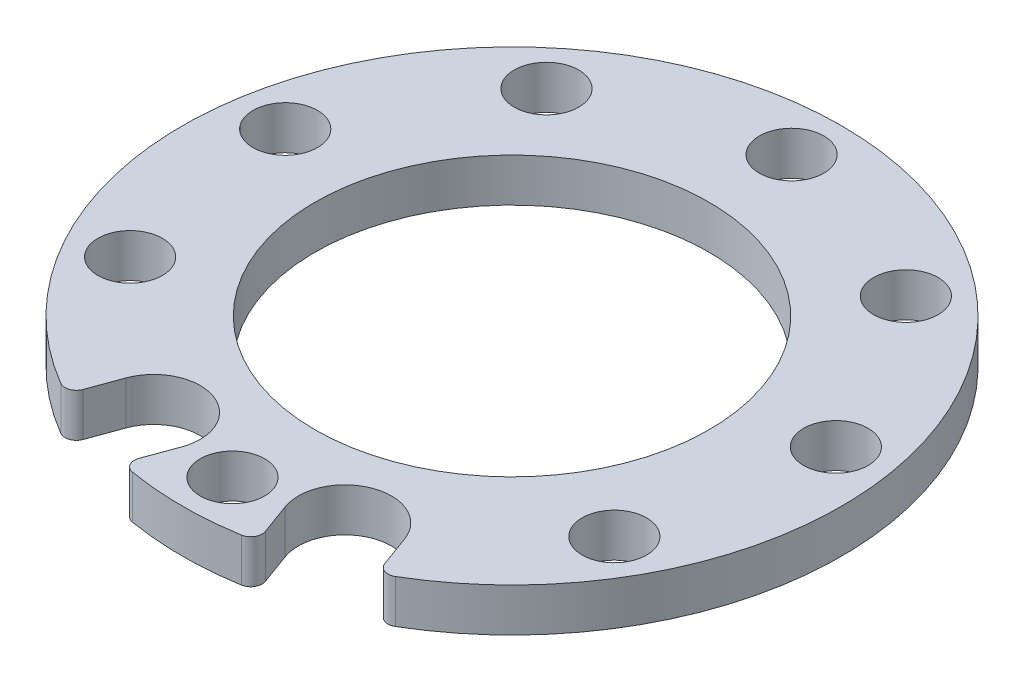
from build123d import *

# Parameters (mm, degrees)
SKETCH1_R            = 45.974
SKETCH1_R_2          = 27.4955
SKETCH1_R_3          = 6.5
BOSS_EXTRUDE1_DEPTH  = 6.04774
M8_CLEARANCE_HOLE1_D = 9
CIRPATTERN1_COUNT    = 18
CUT_EXTRUDE1_DEPTH   = 66.297722097
FILLET1_R            = 1.5875
FILLET1_OF_MIRROR1_R = 1.5875


with BuildPart() as part:
    # Sketch1 → Boss-Extrude1 (new body)
    with BuildSketch(Plane(origin=(0, 0, 0), x_dir=(1, 0, 0), z_dir=(0, 1, 0))):
        with Locations(Location((0, 0, 0), (0, 0, 270))):
            Circle(SKETCH1_R)
        with Locations(Location((0, 0, 0), (0, 0, 270))):
            Circle(SKETCH1_R_2, mode=Mode.SUBTRACT)
        with Locations(Location((-13.33878559, -36.648012211, 0), (0, 0, 270))):
            Circle(SKETCH1_R_3, mode=Mode.SUBTRACT)
        with Locations(Location((13.33878559, -36.648012211, 0), (0, 0, 270))):
            Circle(SKETCH1_R_3, mode=Mode.SUBTRACT)
    extrude(amount=BOSS_EXTRUDE1_DEPTH)

    # M8 Clearance Hole1 (through all)
    with Locations(Plane(origin=(0, 6.04774, 0), x_dir=(1, 0, 0), z_dir=(0, 1, 0))):
        with Locations((0, 39)):
            m8_clearance_hole1 = Hole(M8_CLEARANCE_HOLE1_D / 2)

    # CirPattern1: M8 Clearance Hole1 ×18 about axis, 10 skipped
    cirpattern1_axis = Axis((0, 6.04774, 0), (0, -1, 0))
    add([m8_clearance_hole1.rotate(cirpattern1_axis, i * 360 / CIRPATTERN1_COUNT) for i in range(1, CIRPATTERN1_COUNT) if i not in (1, 3, 5, 7, 8, 10, 11, 13, 15, 17)], mode=Mode.SUBTRACT)

    # Sketch6 → Cut-Extrude1 (cut, through all)
    with BuildSketch(Plane(origin=(0, 6.04774, 0), x_dir=(1, 0, 0), z_dir=(0, 1, 0))):
        with BuildLine():
            ThreePointArc((-7.230783555, -38.871143142), (-15.561916521, -42.756014246), (-19.446787625, -34.424881279))
            Line((-19.446787625, -34.424881279), (-21.674084917, -40.544330295))
            ThreePointArc((-21.674084917, -40.544330295), (-15.724034069, -43.201428548), (-9.458080846, -44.990592158))
            Line((-9.458080846, -44.990592158), (-7.230783555, -38.871143142))
        make_face()
    cut_extrude1 = extrude(amount=-CUT_EXTRUDE1_DEPTH, mode=Mode.SUBTRACT)

    # Fillet1
    fillet1_edges = [part.edges().sort_by_distance(p)[0] for p in [
        (-9.458080846, 3.02387, 44.990592158),
        (-21.674084917, 3.02387, 40.544330295),
    ]]
    fillet(fillet1_edges, radius=FILLET1_R)

    # Mirror1: Cut-Extrude1 across plane
    add(cut_extrude1.mirror(Plane(origin=(0, 0, 0), x_dir=(0, 0, 1), z_dir=(1, 0, 0))), mode=Mode.SUBTRACT)

    # Fillet1 of Mirror1
    fillet1_of_mirror1_edges = [part.edges().sort_by_distance(p)[0] for p in [
        (9.458080846, 3.02387, 44.990592158),
        (21.674084917, 3.02387, 40.544330295),
    ]]
    fillet(fillet1_of_mirror1_edges, radius=FILLET1_OF_MIRROR1_R)


solid = part.part
